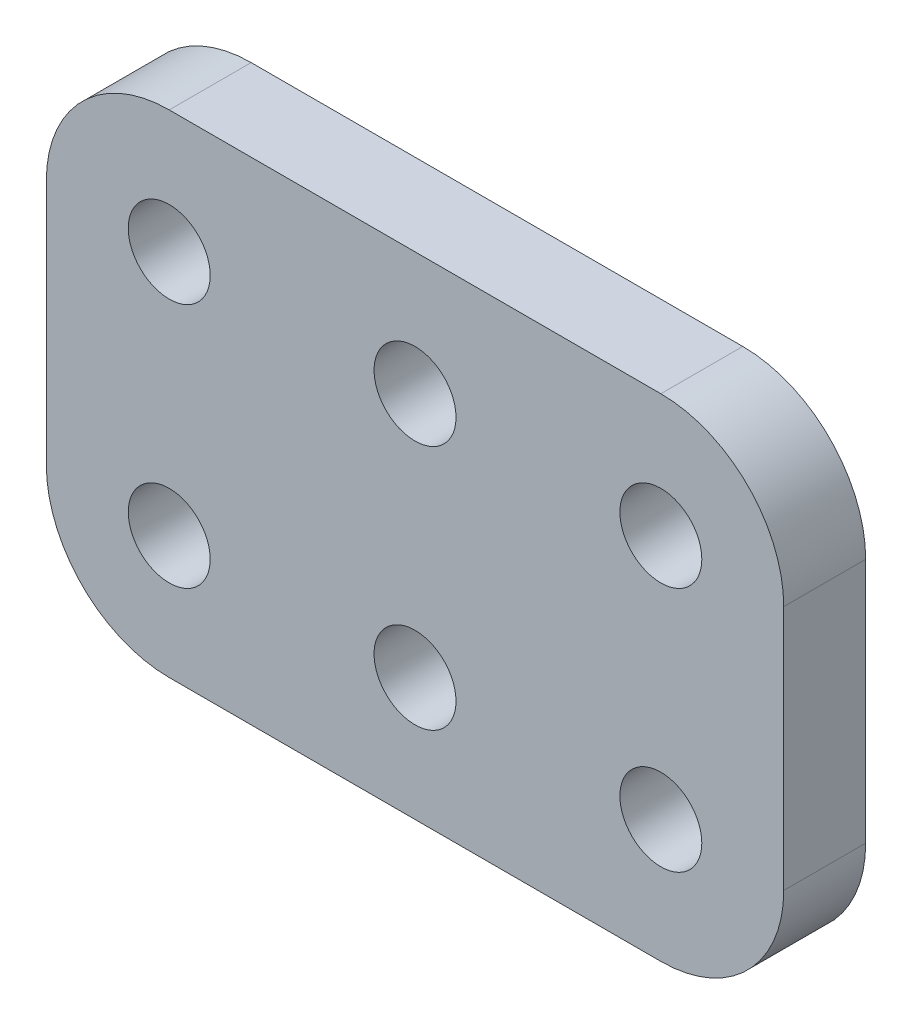
from build123d import *

# Parameters (mm, degrees)
MODEL_R                 = 1.5
SALIENTE_EXTRUIR1_DEPTH = 3


with BuildPart() as part:
    # Model → Saliente-Extruir1 (new body)
    with BuildSketch(Plane.XY):
        with BuildLine():
            Line((195.335922194, 161.333196305), (213.335922194, 161.333196305))
            ThreePointArc((213.335922194, 161.333196305), (216.517902709, 162.651215789), (217.835922194, 165.833196305))
            Line((217.835922194, 165.833196305), (217.835922194, 174.833196305))
            ThreePointArc((217.835922194, 174.833196305), (216.517902709, 178.01517682), (213.335922194, 179.333196305))
            Line((213.335922194, 179.333196305), (195.335922194, 179.333196305))
            ThreePointArc((195.335922194, 179.333196305), (192.153941678, 178.01517682), (190.835922194, 174.833196305))
            Line((190.835922194, 174.833196305), (190.835922194, 165.833196305))
            ThreePointArc((190.835922194, 165.833196305), (192.153941678, 162.651215789), (195.335922194, 161.333196305))
        make_face()
        with Locations((195.335922194, 174.833196305)):
            Circle(MODEL_R, mode=Mode.SUBTRACT)
        with Locations((195.335922194, 165.833196305)):
            Circle(MODEL_R, mode=Mode.SUBTRACT)
        with Locations((204.335922194, 174.833196305)):
            Circle(MODEL_R, mode=Mode.SUBTRACT)
        with Locations((204.335922194, 165.833196305)):
            Circle(MODEL_R, mode=Mode.SUBTRACT)
        with Locations((213.335922194, 174.833196305)):
            Circle(MODEL_R, mode=Mode.SUBTRACT)
        with Locations((213.335922194, 165.833196305)):
            Circle(MODEL_R, mode=Mode.SUBTRACT)
    extrude(amount=SALIENTE_EXTRUIR1_DEPTH)


solid = part.part
